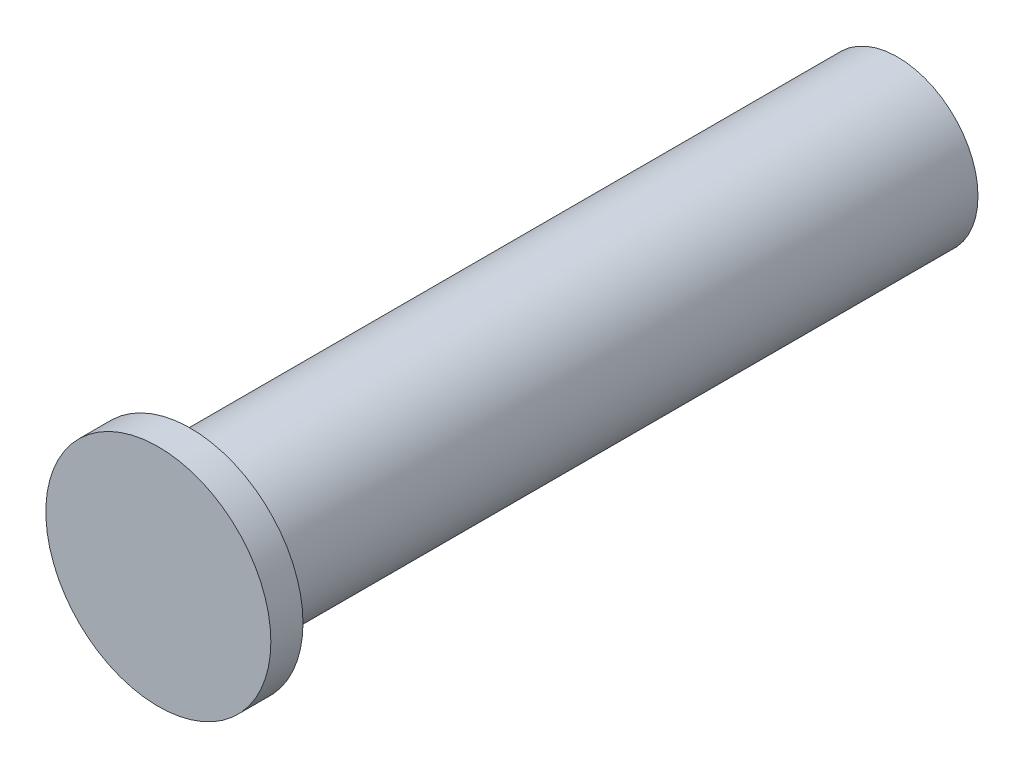
from build123d import *

# Parameters (mm, degrees)
SKETCH1_R           = 12.5
BOSS_EXTRUDE1_DEPTH = 110
SKETCH2_R           = 17.5
BOSS_EXTRUDE2_DEPTH = 5


with BuildPart() as part:
    # Sketch1 → Boss-Extrude1 (new body)
    with BuildSketch(Plane.XY):
        Circle(SKETCH1_R)
    extrude(amount=BOSS_EXTRUDE1_DEPTH)

    # Sketch2 → Boss-Extrude2 (add)
    with BuildSketch(Plane.XY.offset(110)):
        Circle(SKETCH2_R)
    extrude(amount=BOSS_EXTRUDE2_DEPTH)


solid = part.part
